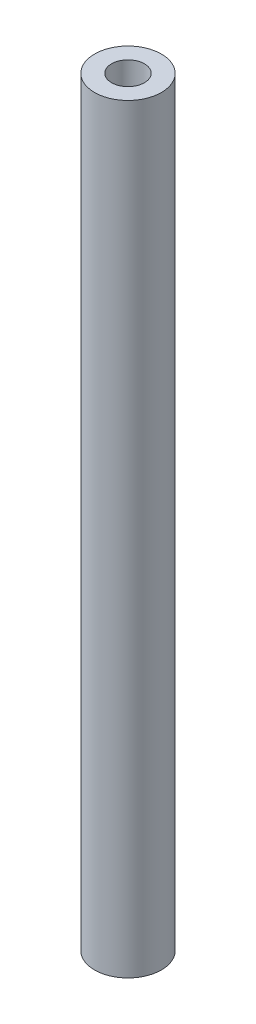
from build123d import *

# Parameters (mm, degrees)
SKETCH1_R           = 3.25
SKETCH1_R_2         = 1.6
BOSS_EXTRUDE1_DEPTH = 74


with BuildPart() as part:
    # Sketch1 → Boss-Extrude1 (new body)
    with BuildSketch(Plane(origin=(0, 0, 0), x_dir=(1, 0, 0), z_dir=(0, 1, 0))):
        with Locations(Location((0, 0, 0), (0, 0, 270))):
            Circle(SKETCH1_R)
        with Locations(Location((0, 0, 0), (0, 0, 270))):
            Circle(SKETCH1_R_2, mode=Mode.SUBTRACT)
    extrude(amount=BOSS_EXTRUDE1_DEPTH)


solid = part.part
